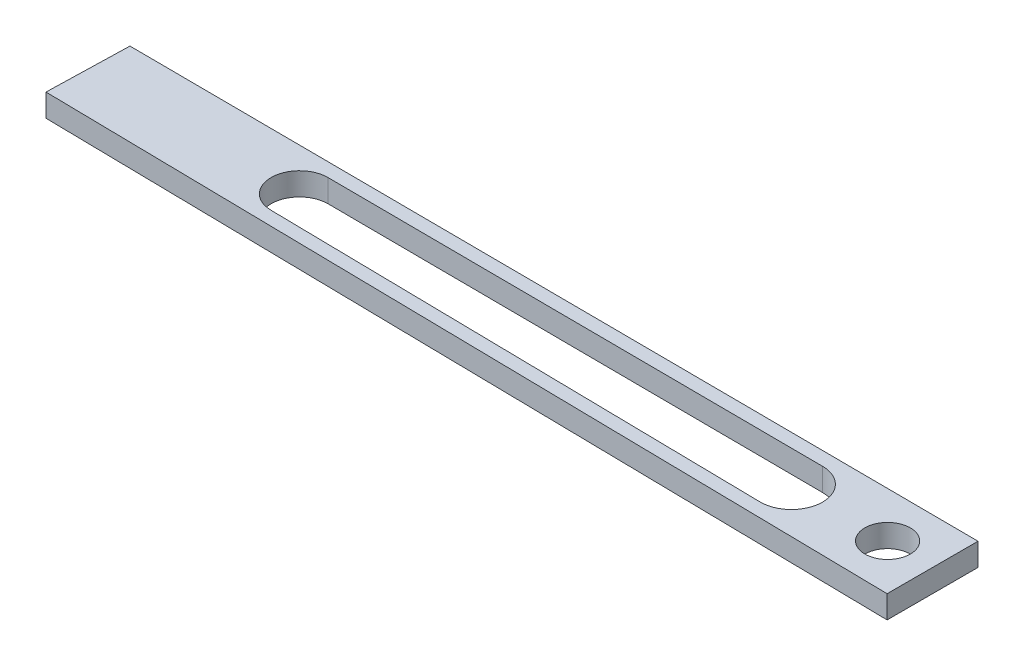
from build123d import *

# Parameters (mm, degrees)
BOSS_EXTRUDE1_DEPTH = 5
CUT_EXTRUDE1_DEPTH  = 1.5
CUT_EXTRUDE2_DEPTH  = 117.810049896
SKETCH1_11_R        = 5
CUT_EXTRUDE4_DEPTH  = 117.810049896


with BuildPart() as part:
    # Sketch1 → Boss-Extrude1 (new body)
    with BuildSketch(Plane(origin=(0, 0, 0), x_dir=(1, 0, 0), z_dir=(0, 1, 0))):
        Polygon((-89.9999746, -42.847712915), (-90.474893649, -60.847712915), (97.64978611, -63.907018624), (97.64978611, -43.907018893), align=None)
    extrude(amount=BOSS_EXTRUDE1_DEPTH)

    # Sketch1<7> → Cut-Extrude1 (cut)
    with BuildSketch(Plane(origin=(0, 0, 0), x_dir=(1, 0, 0), z_dir=(0, 1, 0))):
        with BuildLine():
            Line((-72.436927027, -45.130599461), (-72.436927027, -48.430599461))
            Line((-72.436927027, -48.430599461), (-87.431604768, -50.393286254))
            ThreePointArc((-87.431604768, -50.393286254), (-88.736927027, -51.880599461), (-87.431604768, -53.367912669))
            Line((-87.431604768, -53.367912669), (-72.436927027, -55.330599461))
            Line((-72.436927027, -55.330599461), (-72.436927027, -58.630599461))
            ThreePointArc((-72.436927027, -58.630599461), (-70.536927027, -60.530599461), (-68.636927027, -58.630599461))
            Line((-68.636927027, -58.630599461), (-68.636927027, -54.780599461))
            Line((-68.636927027, -54.780599461), (-55.641618403, -54.056431677))
            ThreePointArc((-55.641618403, -54.056431677), (-53.998192666, -52.22471247), (-55.641618403, -50.392993263))
            Line((-55.641618403, -50.392993263), (-68.636927027, -48.980599461))
            Line((-68.636927027, -48.980599461), (-68.636927027, -45.130599461))
            ThreePointArc((-68.636927027, -45.130599461), (-70.536927027, -43.230599461), (-72.436927027, -45.130599461))
        make_face()
    extrude(amount=CUT_EXTRUDE1_DEPTH, mode=Mode.SUBTRACT)

    # Sketch1<9> → Cut-Extrude2 (cut, through all)
    with BuildSketch(Plane(origin=(0, 0, 0), x_dir=(1, 0, 0), z_dir=(0, 1, 0))):
        with BuildLine():
            Line((-43.135065573, -46.112318891), (66.303161817, -46.73083337))
            ThreePointArc((66.303161817, -46.73083337), (73.096439635, -53.63791869), (66.153429754, -60.394424507))
            Line((66.153429754, -60.394424507), (-43.272048174, -58.614120743))
            ThreePointArc((-43.272048174, -58.614120743), (-49.421343824, -52.295091347), (-43.135065573, -46.112318891))
        make_face()
    extrude(amount=CUT_EXTRUDE2_DEPTH, mode=Mode.SUBTRACT)

    # Sketch1<11> → Cut-Extrude4 (cut, through all)
    with BuildSketch(Plane(origin=(0, 0, 0), x_dir=(1, 0, 0), z_dir=(0, 1, 0))):
        with Locations(Location((87.64978611, -53.797415464, 0), (0, 0, 270))):
            Circle(SKETCH1_11_R)
    extrude(amount=CUT_EXTRUDE4_DEPTH, mode=Mode.SUBTRACT)


solid = part.part
